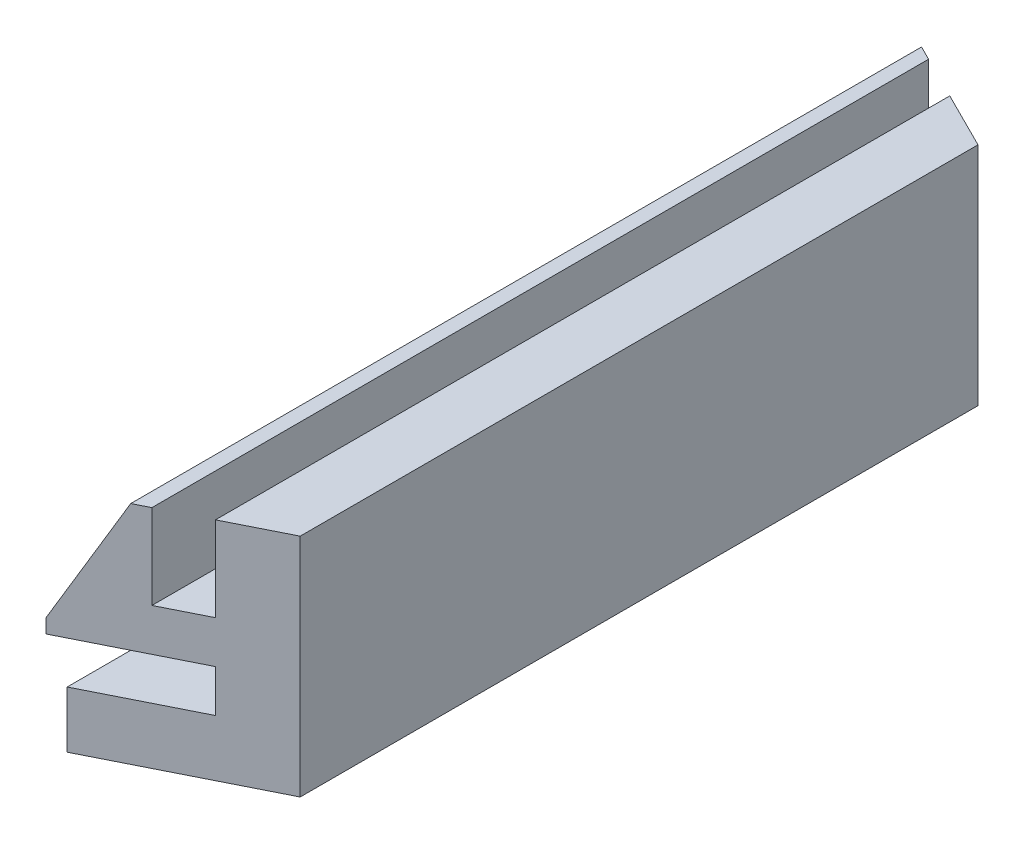
from build123d import *

# Parameters (mm, degrees)
DODANIE_WYCI_GNI_CIE1_DEPTH = 70
SZKIC2_OUTSIDE_W            = 28.56
SZKIC2_OUTSIDE_H            = 86.56
WYTNIJ_WYCI_GNI_CIE1_DEPTH  = 73.249567473


with BuildPart() as part:
    # Szkic1 → Dodanie-wyciągnięcie1 (new body)
    with BuildSketch(Plane.XY):
        Polygon((0, 0), (-7, 0), (-7, -4), (-0.506849315, -4), (4, -4), (4, 12), (0, 12), (0, 6), (-3, 6), (-3, 12), (-4, 12), (-8, 4), (-8, 3), (0, 3), align=None)
    extrude(amount=DODANIE_WYCI_GNI_CIE1_DEPTH)

    # Szkic2 outside → Wytnij-wyciągnięcie1 (cut, through all)
    with BuildSketch(Plane(origin=(0, 12, 0), x_dir=(1, 0, 0), z_dir=(0, 1, 0))):
        with Locations((-2, -35)):
            Rectangle(SZKIC2_OUTSIDE_W, SZKIC2_OUTSIDE_H)
        Polygon((-15.924171966, -0.266842792), (4, -10.231080013), (4, -58.231080013), (-15.924171966, -68.195317233), align=None, mode=Mode.SUBTRACT)
    extrude(amount=-WYTNIJ_WYCI_GNI_CIE1_DEPTH, mode=Mode.SUBTRACT)


solid = part.part
